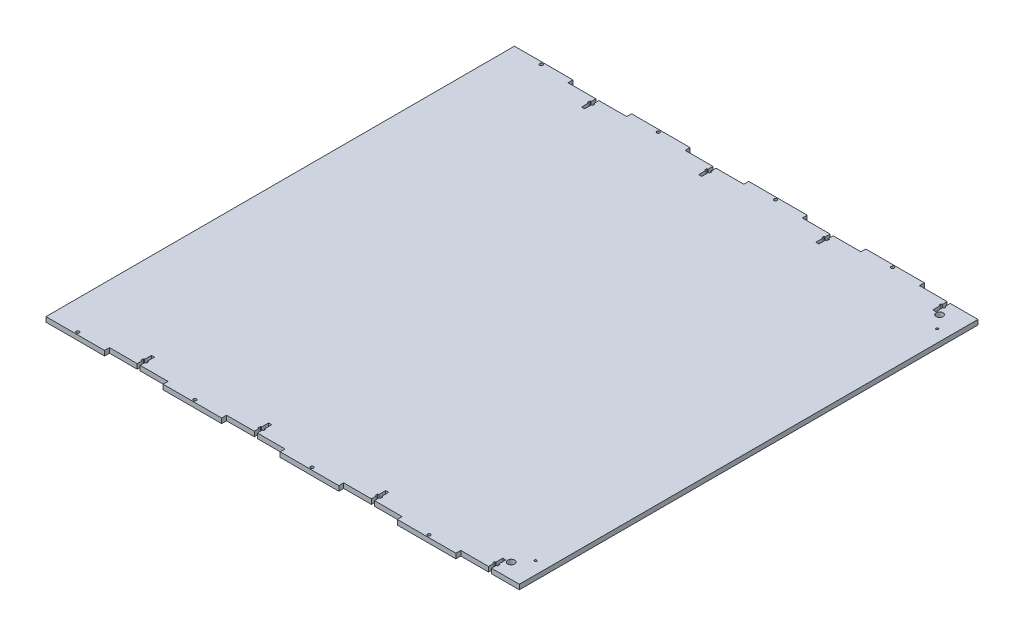
from build123d import *

# Parameters (mm, degrees)
SKETCH1_W           = 609.6
SKETCH1_H           = 304.8
BOSS_EXTRUDE1_DEPTH = 3.175
SKETCH2_R           = 2
SKETCH2_R_2         = 4.5
SKETCH2_R_3         = 1.5
CUT_EXTRUDE1_DEPTH  = 432.099063441


with BuildPart() as part:
    # Sketch1 → Boss-Extrude1 (new, symmetric)
    with BuildSketch(Plane(origin=(0, 0, 0), x_dir=(1, 0, 0), z_dir=(0, 1, 0))):
        with Locations((0, -152.4)):
            Rectangle(SKETCH1_W, SKETCH1_H)
    boss_extrude1 = extrude(amount=BOSS_EXTRUDE1_DEPTH, both=True)

    # Sketch2 → Cut-Extrude1 (cut, symmetric)
    with BuildSketch(Plane(origin=(0, 3.175, 0), x_dir=(1, 0, 0), z_dir=(0, 1, 0))):
        with Locations(Location((-266.7, -301.625, 0), (0, 0, 270))):
            Circle(SKETCH2_R)
        Polygon((-228.6, -298.45), (-228.6, -304.8), (-152.4, -304.8), (-152.4, -298.45), (-188.5, -298.45), (-192.5, -298.45), align=None)
        Polygon((-192.5, -292.05), (-192.5, -298.45), (-188.5, -298.45), (-188.5, -292.05), (-187.11, -292.05), (-187.11, -288.85), (-188.5, -288.85), (-188.5, -279.8), (-192.5, -279.8), (-192.5, -288.85), (-193.89, -288.85), (-193.89, -292.05), align=None)
        with Locations(Location((-114.3, -301.625, 0), (0, 0, 270))):
            Circle(SKETCH2_R)
        Polygon((-76.2, -298.45), (-76.2, -304.8), (0, -304.8), (0, -298.45), (-36.1, -298.45), (-40.1, -298.45), align=None)
        Polygon((-40.1, -292.05), (-40.1, -298.45), (-36.1, -298.45), (-36.1, -292.05), (-34.71, -292.05), (-34.71, -288.85), (-36.1, -288.85), (-36.1, -279.8), (-40.1, -279.8), (-40.1, -288.85), (-41.49, -288.85), (-41.49, -292.05), align=None)
        with Locations(Location((38.1, -301.625, 0), (0, 0, 270))):
            Circle(SKETCH2_R)
        Polygon((76.2, -298.45), (76.2, -304.8), (152.4, -304.8), (152.4, -298.45), (116.3, -298.45), (112.3, -298.45), align=None)
        Polygon((112.3, -292.05), (112.3, -298.45), (116.3, -298.45), (116.3, -292.05), (117.69, -292.05), (117.69, -288.85), (116.3, -288.85), (116.3, -279.8), (112.3, -279.8), (112.3, -288.85), (110.91, -288.85), (110.91, -292.05), align=None)
        with Locations(Location((190.5, -301.625, 0), (0, 0, 270))):
            Circle(SKETCH2_R)
        Polygon((228.6, -298.45), (228.6, -304.8), (304.8, -304.8), (304.8, -298.45), (268.7, -298.45), (264.7, -298.45), align=None)
        Polygon((264.7, -292.05), (264.7, -298.45), (268.7, -298.45), (268.7, -292.05), (270.09, -292.05), (270.09, -288.85), (268.7, -288.85), (268.7, -279.8), (264.7, -279.8), (264.7, -288.85), (263.31, -288.85), (263.31, -292.05), align=None)
        with Locations(Location((274.46, -278.775, 0), (0, 0, 270))):
            Circle(SKETCH2_R_2)
        with Locations(Location((288.8, -261.3, 0), (0, 0, 270))):
            Circle(SKETCH2_R_3)
    cut_extrude1 = extrude(amount=CUT_EXTRUDE1_DEPTH, both=True, mode=Mode.SUBTRACT)

    # Mirror1: Boss-Extrude1, Cut-Extrude1 across plane
    add(boss_extrude1.mirror(Plane(origin=(0, 3.175, 0), x_dir=(1, 0, 0), z_dir=(0, 0, -1))))
    add(cut_extrude1.mirror(Plane(origin=(0, 3.175, 0), x_dir=(1, 0, 0), z_dir=(0, 0, -1))), mode=Mode.SUBTRACT)


solid = part.part
